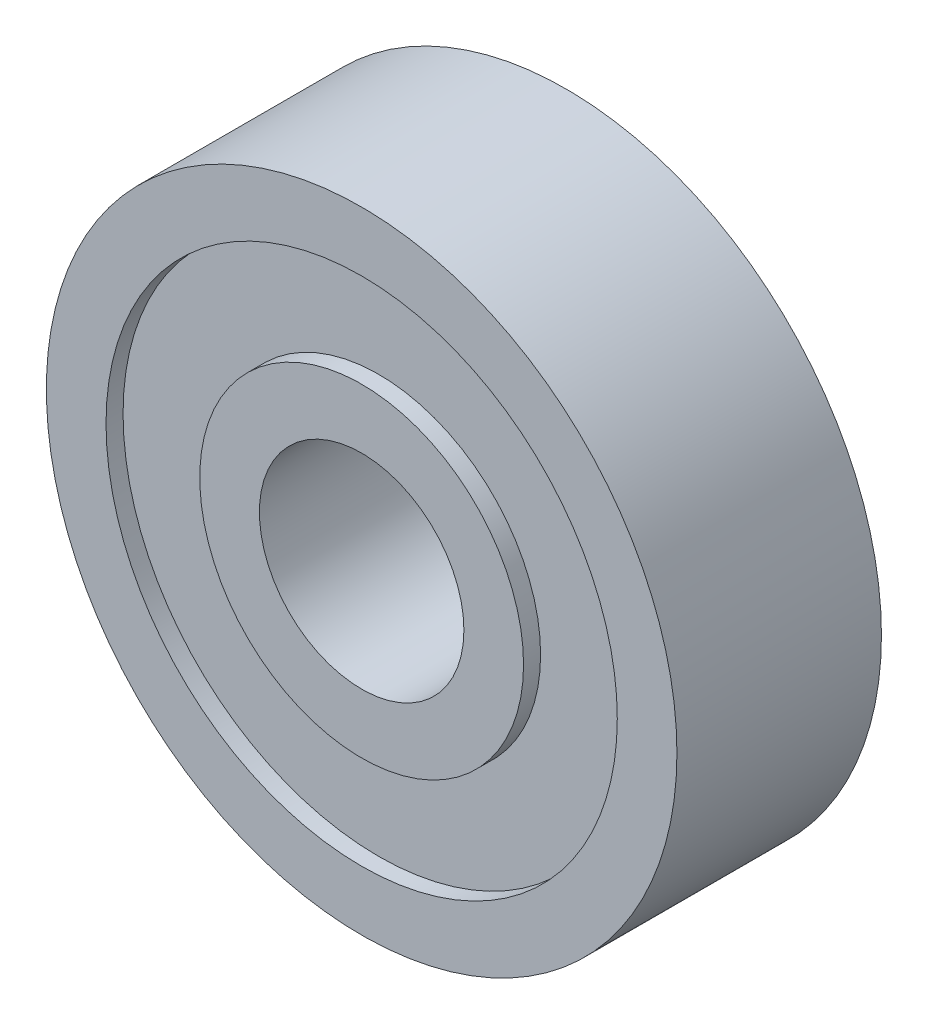
from build123d import *

# Parameters (mm, degrees)
SKETCH1_R           = 18.5
BOSS_EXTRUDE1_DEPTH = 12
SKETCH2_R           = 6
CUT_EXTRUDE1_DEPTH  = 12
SKETCH3_R           = 15
SKETCH3_R_2         = 9.5
CUT_EXTRUDE2_DEPTH  = 1
CUT_EXTRUDE3_START  = -1
SKETCH4_R           = 15
SKETCH4_R_2         = 9.5
CUT_EXTRUDE3_DEPTH  = 1


with BuildPart() as part:
    # Sketch1 → Boss-Extrude1 (new body)
    with BuildSketch(Plane.XY):
        Circle(SKETCH1_R)
    extrude(amount=BOSS_EXTRUDE1_DEPTH)

    # Sketch2 → Cut-Extrude1 (cut)
    with BuildSketch(Plane.XY.offset(12)):
        Circle(SKETCH2_R)
    extrude(amount=-CUT_EXTRUDE1_DEPTH, mode=Mode.SUBTRACT)

    # Sketch3 → Cut-Extrude2 (cut)
    with BuildSketch(Plane.XY.offset(12)):
        Circle(SKETCH3_R)
        Circle(SKETCH3_R_2, mode=Mode.SUBTRACT)
    extrude(amount=-CUT_EXTRUDE2_DEPTH, mode=Mode.SUBTRACT)

    # Sketch4 → Cut-Extrude3 (cut)
    with BuildSketch(Plane(origin=(0, 0, 0), x_dir=(-1, 0, 0), z_dir=(0, 0, -1)).offset(CUT_EXTRUDE3_START)):
        with Locations(Location((0, 0, 0), (0, 0, 180))):
            Circle(SKETCH4_R)
        with Locations(Location((0, 0, 0), (0, 0, 180))):
            Circle(SKETCH4_R_2, mode=Mode.SUBTRACT)
    extrude(amount=CUT_EXTRUDE3_DEPTH, mode=Mode.SUBTRACT)


solid = part.part
